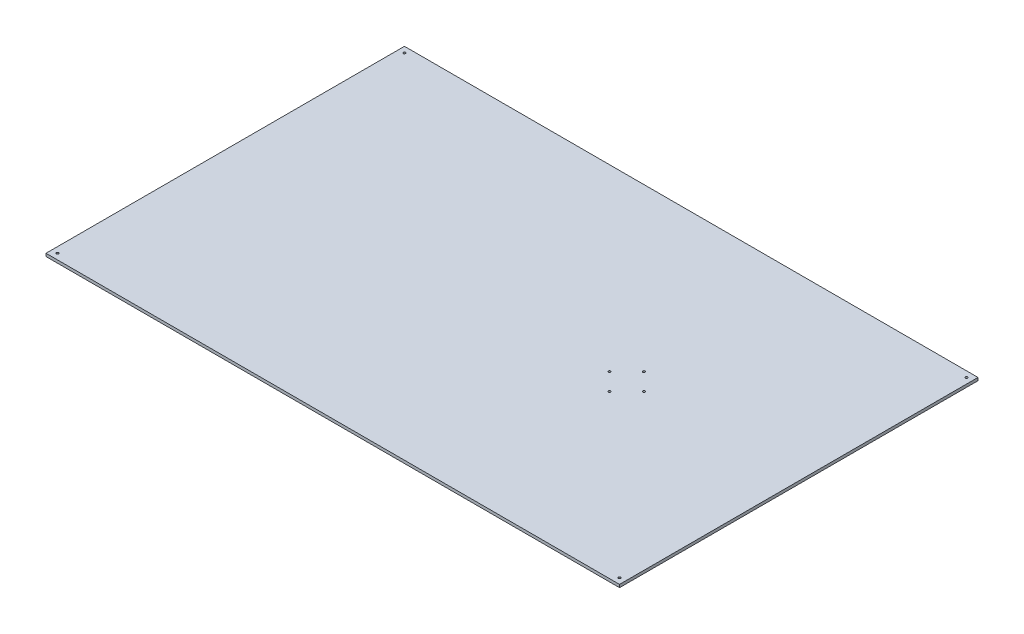
from build123d import *

# Parameters (mm, degrees)
SKETCH_2_W      = 2000
SKETCH_2_H      = 1250
EXTRUDE_1_DEPTH = 10
MM_1_D          = 8
MM_1_DEPTH      = 20
MM_1_TIP        = 2.403442476
MM_2_D          = 8
MM_2_DEPTH      = 20
MM_2_TIP        = 2.403442476


with BuildPart() as part:
    # 草图2 → 凸台-拉伸1 (new body)
    with BuildSketch(Plane(origin=(0, 0, 0), x_dir=(1, 0, 0), z_dir=(0, 1, 0))):
        Rectangle(SKETCH_2_W, SKETCH_2_H)
    extrude(amount=EXTRUDE_1_DEPTH)

    # 大小mm 暗销孔1
    with Locations(Plane(origin=(-980, 10, -605), x_dir=(0, 0, 1), z_dir=(0, 1, 0))):
        with Locations((0, 0), (0, 1960), (1210, 1960), (1210, 0)):
            Hole(MM_1_D / 2, depth=MM_1_DEPTH)
            with Locations((0, 0, -(MM_1_DEPTH + MM_1_TIP / 2))):  # 118° drill point
                Cone(0, MM_1_D / 2, MM_1_TIP, mode=Mode.SUBTRACT)

    # 大小mm 暗销孔2
    with Locations(Plane(origin=(400, 10, -60), x_dir=(0, 0, 1), z_dir=(0, 1, 0))):
        with Locations((0, 0), (60, -60), (120, 0), (60, 60)):
            Hole(MM_2_D / 2, depth=MM_2_DEPTH)
            with Locations((0, 0, -(MM_2_DEPTH + MM_2_TIP / 2))):  # 118° drill point
                Cone(0, MM_2_D / 2, MM_2_TIP, mode=Mode.SUBTRACT)


solid = part.part
